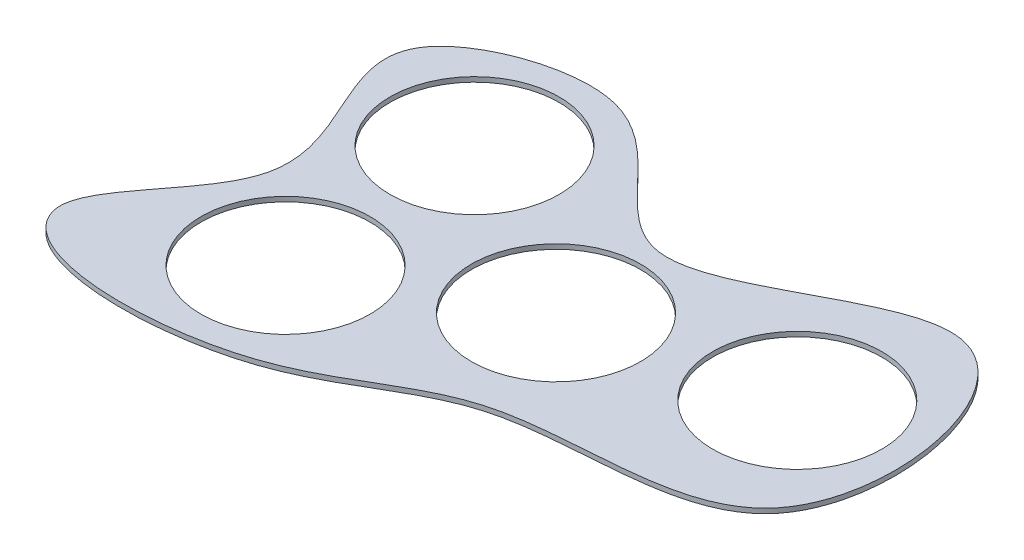
from build123d import *

# Parameters (mm, degrees)
SKETCH1_R           = 55.88
BOSS_EXTRUDE1_DEPTH = 3.175


with BuildPart() as part:
    # Sketch1 → Boss-Extrude1 (new body)
    with BuildSketch(Plane(origin=(0, 0, 0), x_dir=(1, 0, 0), z_dir=(0, 1, 0))):
        with BuildLine():
            add(Edge.make_bspline(
                [(0, 56.64447092), (-0.077854196, 80.520160649), (99.487755187, 156.747058418), (-29.045563059, 261.573495279), (153.729500324, 329.972611972), (209.806238473, 169.252495945), (409.016180275, 359.180610617), (462.641278475, 68.159794595), (250.715074532, 106.079695571), (163.766720813, 15.840756053), (10.914348799, 15.872477877), (0.012656604, 52.763046877), (0, 56.64447092)],
                knots=[0, 0, 0, 0, 0.081741375, 0.199999708, 0.274551071, 0.379128225, 0.494918652, 0.643465068, 0.770629802, 0.86711465, 0.986711465, 1, 1, 1, 1], degree=3))
        make_face()
        with Locations(Location((102.486134685, 227.958678445, 0), (0, 0, 270))):
            Circle(SKETCH1_R, mode=Mode.SUBTRACT)
        with Locations(Location((225.03630349, 159.227707713, 0), (0, 0, 270))):
            Circle(SKETCH1_R, mode=Mode.SUBTRACT)
        with Locations(Location((108.537567991, 97.03980341, 0), (0, 0, 270))):
            Circle(SKETCH1_R, mode=Mode.SUBTRACT)
        with Locations(Location((354.832588956, 188.836057119, 0), (0, 0, 270))):
            Circle(SKETCH1_R, mode=Mode.SUBTRACT)
    extrude(amount=BOSS_EXTRUDE1_DEPTH)


solid = part.part
